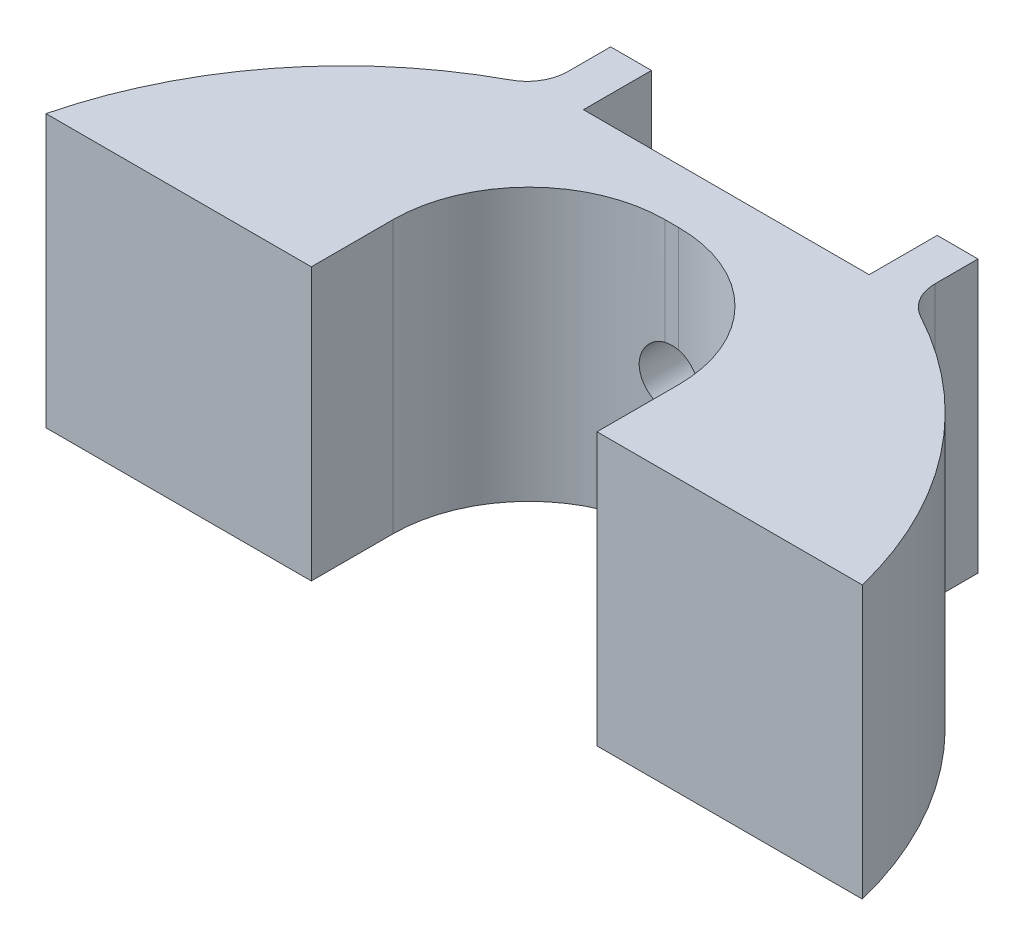
from build123d import *

# Parameters (mm, degrees)
SKETCH_1_W          = 21
SKETCH_1_H          = 4
SKETCH_1_W_2        = 3
SKETCH_1_H_2        = 5
EXTRUDE_1_DEPTH     = 20
FILLET_1_R          = 10
FILLET_2_R          = 3
CUT_EXTRUDE_1_REACH = 51.399
SKETCH_2_R          = 2.25


with BuildPart() as part:
    # 草图1 → 凸台-拉伸1 (new body)
    with BuildSketch(Plane(origin=(0, 0, 0), x_dir=(1, 0, 0), z_dir=(0, 1, 0))):
        with BuildLine():
            Line((0, -4), (0, 0))
            Line((0, 0), (-3, 0))
            ThreePointArc((-3, 0), (-13.522200743, -8.125434387), (-19.5, -20))
            Line((-19.5, -20), (0, -20))
            Line((0, -20), (0, -4))
        make_face()
        with Locations((10.5, -2)):
            Rectangle(SKETCH_1_W, SKETCH_1_H)
        with Locations((-1.5, 2.5)):
            Rectangle(SKETCH_1_W_2, SKETCH_1_H_2)
        with Locations((22.5, 2.5)):
            Rectangle(SKETCH_1_W_2, SKETCH_1_H_2)
        with BuildLine():
            Line((24, 0), (21, 0))
            Line((21, 0), (21, -4))
            Line((21, -4), (21, -20))
            Line((21, -20), (40.5, -20))
            ThreePointArc((40.5, -20), (34.522200743, -8.125434387), (24, 0))
        make_face()
    extrude(amount=EXTRUDE_1_DEPTH)

    # 圆角1
    fillet_1_edges = [part.edges().sort_by_distance(p)[0] for p in [
        (21, 10, 4),
        (0, 10, 4),
    ]]
    fillet(fillet_1_edges, radius=FILLET_1_R)

    # 圆角2
    fillet_2_edges = [part.edges().sort_by_distance(p)[0] for p in [
        (24, 10, 0),
        (-3, 10, 0),
    ]]
    fillet(fillet_2_edges, radius=FILLET_2_R)

    # 草图2 → 切除-拉伸1 (cut, up to next)
    with BuildSketch(Plane(origin=(0, 0, 0), x_dir=(-1, 0, 0), z_dir=(0, 0, -1)), mode=Mode.PRIVATE) as cut_extrude_1_sk1:
        with Locations((-10.5, 10)):
            Circle(SKETCH_2_R)
    cut_extrude_1_tool1 = extrude(cut_extrude_1_sk1.sketch, amount=-CUT_EXTRUDE_1_REACH, mode=Mode.PRIVATE) & part.part
    add(cut_extrude_1_tool1.solids().sort_by_distance((10.5, 10, 0))[0], mode=Mode.SUBTRACT)


solid = part.part
